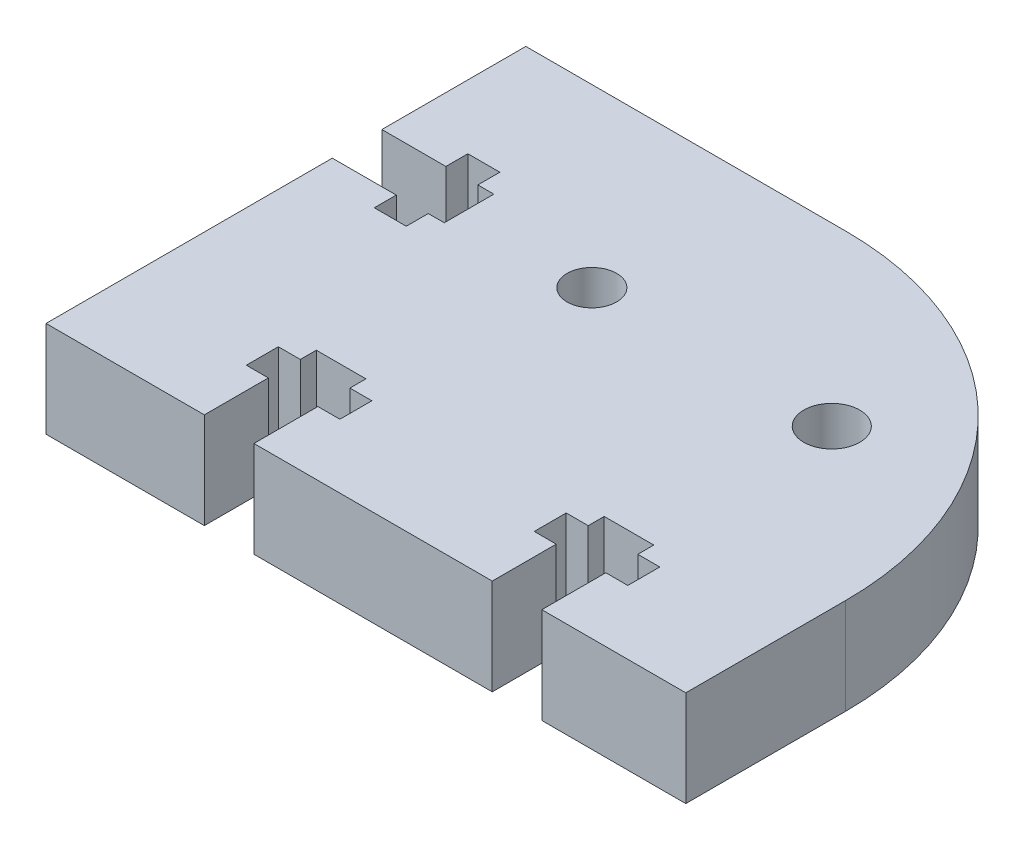
from build123d import *

# Parameters (mm, degrees)
DODANIE_WYCI_GNI_CIE1_DEPTH = 6
WYTNIJ_WYCI_GNI_CIE1_DEPTH  = 6
SZYK_LINIOWY1_COUNT         = 2
SZYK_LINIOWY1_PITCH         = 18
WYTNIJ_WYCI_GNI_CIE2_DEPTH  = 6
SZKIC6_R                    = 1.75
SZKIC6_R_2                  = 1.55
WYTNIJ_WYCI_GNI_CIE3_DEPTH  = 6


with BuildPart() as part:
    # Szkic3 → Dodanie-wyciągnięcie1 (new body)
    with BuildSketch(Plane(origin=(0, 0, 0), x_dir=(1, 0, 0), z_dir=(0, 1, 0))):
        with BuildLine():
            Line((-425.43845817, -113.179624371), (-425.43845817, -103.179624371))
            ThreePointArc((-425.43845817, -103.179624371), (-431.296322547, -89.037488748), (-445.43845817, -83.179624371))
            Line((-445.43845817, -83.179624371), (-465.43845817, -83.179624371))
            Line((-465.43845817, -83.179624371), (-465.43845817, -113.179624371))
            Line((-465.43845817, -113.179624371), (-425.43845817, -113.179624371))
        make_face()
    extrude(amount=DODANIE_WYCI_GNI_CIE1_DEPTH)

    # Szkic4 → Wytnij-wyciągnięcie1 (cut)
    with BuildSketch(Plane(origin=(0, 6, 0), x_dir=(1, 0, 0), z_dir=(0, 1, 0))):
        Polygon((-434.43845817, -113.179624371), (-437.53845817, -113.179624371), (-437.53845817, -109.179624371), (-438.91345817, -109.179624371), (-438.91345817, -107.179624371), (-437.53845817, -107.179624371), (-437.53845817, -106.179624371), (-434.43845817, -106.179624371), (-434.43845817, -107.179624371), (-433.06345817, -107.179624371), (-433.06345817, -109.179624371), (-434.43845817, -109.179624371), align=None)
    wytnij_wyci_gni_cie1 = extrude(amount=-WYTNIJ_WYCI_GNI_CIE1_DEPTH, mode=Mode.SUBTRACT)

    # Szyk liniowy1: Wytnij-wyciągnięcie1 ×2
    with Locations(*[(-i * SZYK_LINIOWY1_PITCH, 0, 0) for i in range(1, SZYK_LINIOWY1_COUNT)]):
        add(wytnij_wyci_gni_cie1, mode=Mode.SUBTRACT)

    # Szkic5 → Wytnij-wyciągnięcie2 (cut)
    with BuildSketch(Plane(origin=(0, 6, 0), x_dir=(1, 0, 0), z_dir=(0, 1, 0))):
        Polygon((-465.43845817, -95.279624371), (-465.43845817, -92.179624371), (-461.43845817, -92.179624371), (-461.43845817, -90.804624371), (-459.43845817, -90.804624371), (-459.43845817, -92.179624371), (-458.43845817, -92.179624371), (-458.43845817, -95.279624371), (-459.43845817, -95.279624371), (-459.43845817, -96.654624371), (-461.43845817, -96.654624371), (-461.43845817, -95.279624371), align=None)
    extrude(amount=-WYTNIJ_WYCI_GNI_CIE2_DEPTH, mode=Mode.SUBTRACT)

    # Szkic6 → Wytnij-wyciągnięcie3 (cut)
    with BuildSketch(Plane(origin=(0, 6, 0), x_dir=(1, 0, 0), z_dir=(0, 1, 0))):
        with Locations(Location((-435.310416703, -94.179624371, 0), (0, 0, 270))):
            Circle(SZKIC6_R)
        with Locations(Location((-450.310416703, -94.179624371, 0), (0, 0, 270))):
            Circle(SZKIC6_R_2)
    extrude(amount=-WYTNIJ_WYCI_GNI_CIE3_DEPTH, mode=Mode.SUBTRACT)


solid = part.part
